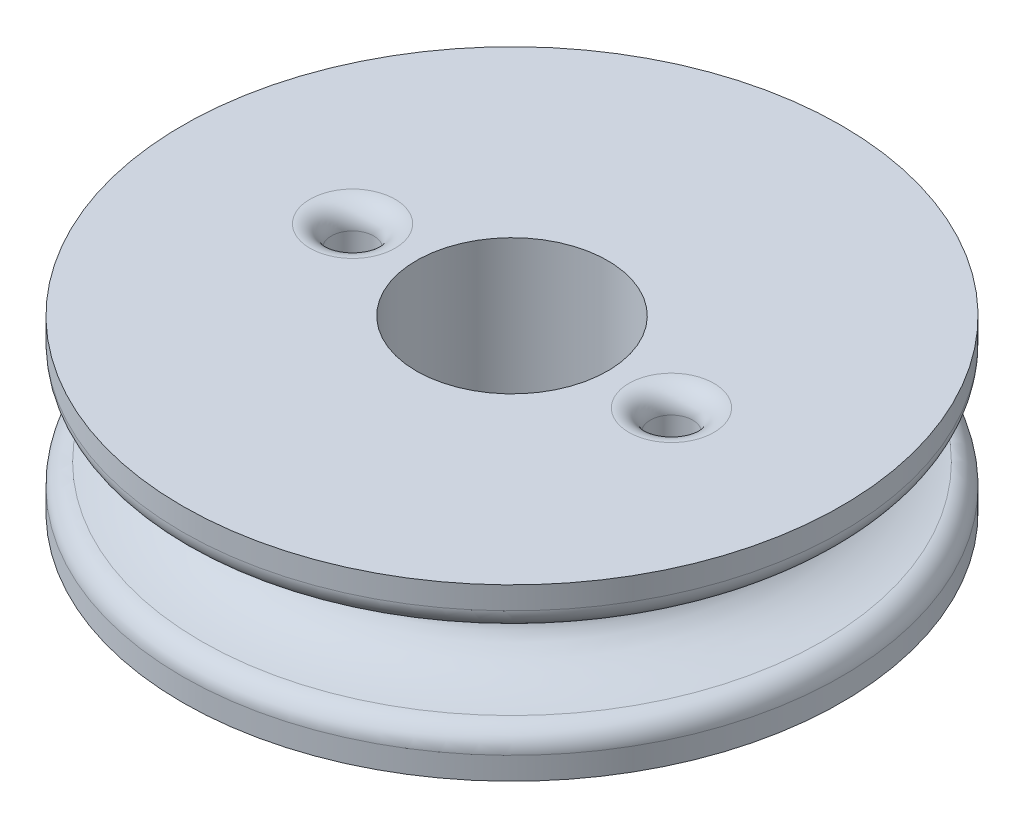
from build123d import *

# Parameters (mm, degrees)
SKETCH2_R           = 15.5
SKETCH2_R_2         = 4.5
SKETCH2_R_3         = 1
BOSS_EXTRUDE1_DEPTH = 8
FILLET1_R           = 1
FILLET2_R           = 1


with BuildPart() as part:
    # Sketch2 → Boss-Extrude1 (new body)
    with BuildSketch(Plane(origin=(0, 0, 0), x_dir=(1, 0, 0), z_dir=(0, 1, 0))):
        with Locations(Location((0, 0, 0), (0, 0, 270))):
            Circle(SKETCH2_R)
        with Locations(Location((0, 0, 0), (0, 0, 270))):
            Circle(SKETCH2_R_2, mode=Mode.SUBTRACT)
        with Locations(Location((7.5, 0, 0), (0, 0, 270))):
            Circle(SKETCH2_R_3, mode=Mode.SUBTRACT)
        with Locations(Location((-7.5, 0, 0), (0, 0, 90))):
            Circle(SKETCH2_R_3, mode=Mode.SUBTRACT)
    extrude(amount=BOSS_EXTRUDE1_DEPTH)

    # Fillet1
    fillet1_edges = [part.edges().sort_by_distance(p)[0] for p in [
        (-7.5, 8, 1),
        (7.5, 8, -1),
    ]]
    fillet(fillet1_edges, radius=FILLET1_R)

    # Sketch4 → Cut-Revolve1 (revolve, cut)
    with BuildSketch(Plane.XY, mode=Mode.PRIVATE) as cut_revolve1_sk:
        with BuildLine():
            ThreePointArc((-15.5, 6), (-17.5, 4), (-15.5, 2))
            add(Edge.make_bspline(
                [(-15.5, 2), (-11.5, 2), (-11.5, 4), (-11.5, 6), (-15.5, 6)],
                knots=[4.71238898, 4.71238898, 4.71238898, 6.283185307, 6.283185307, 7.853981634, 7.853981634, 7.853981634], degree=2, weights=[1, 0.707106781, 1, 0.707106781, 1]))
        make_face()
    revolve(cut_revolve1_sk.sketch.rotate(Axis((0, 9.604734324, 0), (0, -1, 0)), 270), axis=Axis((0, 9.604734324, 0), (0, -1, 0)), mode=Mode.SUBTRACT)

    # Fillet2
    fillet2_edges = [part.edges().sort_by_distance(p)[0] for p in [
        (0, 6, -15.5),
        (0, 2, -15.5),
    ]]
    fillet(fillet2_edges, radius=FILLET2_R)


solid = part.part
